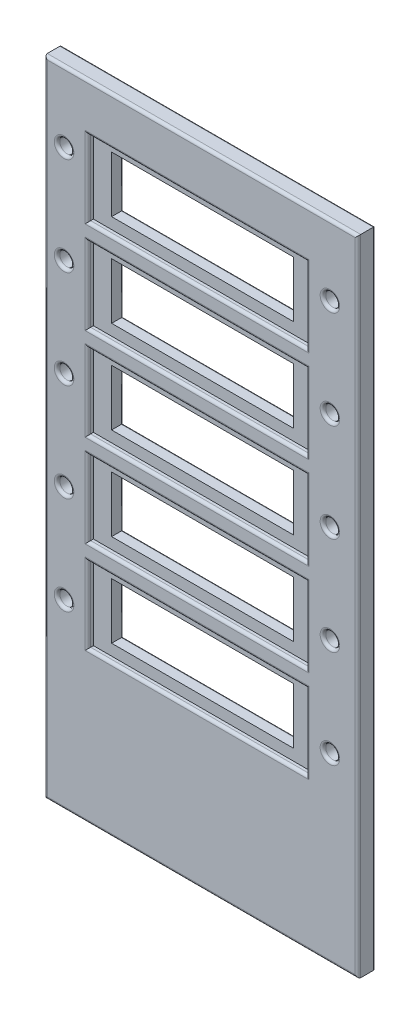
from build123d import *

# Parameters (mm, degrees)
CROQUIS1_W                   = 115
CROQUIS1_H                   = 230
SALIENTE_EXTRUIR1_DEPTH      = 2
CROQUIS2_W                   = 79
CROQUIS2_H                   = 185
CORTAR_EXTRUIR1_DEPTH        = 10
SALIENTE_EXTRUIR2_DEPTH      = 2
SALIENTE_EXTRUIR2_DEPTH_BACK = 2
CROQUIS3_W                   = 115
CROQUIS3_H                   = 230
CROQUIS4_W                   = 65
CROQUIS4_H                   = 20
CORTAR_EXTRUIR2_DEPTH        = 10
MATRIZL1_COUNT               = 5
MATRIZL1_PITCH               = 33
CROQUIS5_W                   = 112
CROQUIS5_H                   = 230
SALIENTE_EXTRUIR3_DEPTH      = 2
CROQUIS6_R                   = 2.5
CORTAR_EXTRUIR3_DEPTH        = 5
MATRIZL2_COUNT               = 5
MATRIZL2_PITCH               = 35
REDONDEO1_R                  = 1
CROQUIS7_R                   = 2.6
CROQUIS7_R_2                 = 2.386504413
CROQUIS7_R_3                 = 2.599045918
CORTAR_EXTRUIR4_DEPTH        = 4.5
REDONDEO2_R                  = 0.5
CROQUIS8_OUTSIDE_W           = 168.444
CROQUIS8_OUTSIDE_H           = 283.444
CROQUIS8_OUTSIDE_W_2         = 112
CROQUIS8_OUTSIDE_H_2         = 230
CORTAR_EXTRUIR6_DEPTH        = 10


with BuildPart() as part:
    # Croquis1 → Saliente-Extruir1 (new body)
    with BuildSketch(Plane.XY):
        Rectangle(CROQUIS1_W, CROQUIS1_H)
    extrude(amount=SALIENTE_EXTRUIR1_DEPTH)

    # Croquis2 → Cortar-Extruir1 (cut)
    with BuildSketch(Plane.XY.offset(2)):
        with Locations((0, 2.5)):
            Rectangle(CROQUIS2_W, CROQUIS2_H)
    extrude(amount=-CORTAR_EXTRUIR1_DEPTH, mode=Mode.SUBTRACT)

    # Croquis3 → Saliente-Extruir2 (add, two sides: drawn at the far end of the back side and taken through both)
    with BuildSketch(Plane.XY.offset(2).offset(-SALIENTE_EXTRUIR2_DEPTH_BACK)):
        Rectangle(CROQUIS3_W, CROQUIS3_H)
    extrude(amount=SALIENTE_EXTRUIR2_DEPTH + SALIENTE_EXTRUIR2_DEPTH_BACK)

    # Croquis4 → Cortar-Extruir2 (cut)
    with BuildSketch(Plane.XY.offset(4)):
        with Locations((0, 85)):
            Rectangle(CROQUIS4_W, CROQUIS4_H)
    cortar_extruir2 = extrude(amount=-CORTAR_EXTRUIR2_DEPTH, mode=Mode.SUBTRACT)

    # MatrizL1: Cortar-Extruir2 ×5
    with Locations(*[(0, -i * MATRIZL1_PITCH, 0) for i in range(1, MATRIZL1_COUNT)]):
        add(cortar_extruir2, mode=Mode.SUBTRACT)

    # Croquis5 → Saliente-Extruir3 (add)
    with BuildSketch(Plane.XY.offset(4)):
        with Locations((1.5, 0)):
            Rectangle(CROQUIS5_W, CROQUIS5_H)
        Polygon((-39, -34), (38.99, -34), (39, -34), (39, -61), (38.99, -61), (-39, -61), (-39.01, -61), (-39.01, -34), align=None, mode=Mode.SUBTRACT)
        Polygon((-39, -1), (38.99, -1), (39, -1), (39, -28), (38.99, -28), (-39, -28), (-39.01, -28), (-39.01, -1), align=None, mode=Mode.SUBTRACT)
        Polygon((-39, 32), (38.99, 32), (39, 32), (39, 5), (38.99, 5), (-39, 5), (-39.01, 5), (-39.01, 32), align=None, mode=Mode.SUBTRACT)
        Polygon((-39, 65), (38.99, 65), (39, 65), (39, 38), (38.99, 38), (-39, 38), (-39.01, 38), (-39.01, 65), align=None, mode=Mode.SUBTRACT)
        Polygon((-39, 98), (38.99, 98), (39, 98), (39, 71), (38.99, 71), (-39, 71), (-39.01, 71), (-39.01, 98), align=None, mode=Mode.SUBTRACT)
    extrude(amount=SALIENTE_EXTRUIR3_DEPTH)

    # Croquis6 → Cortar-Extruir3 (cut)
    with BuildSketch(Plane.XY.offset(6)):
        with Locations((-47.5, 90)):
            Circle(CROQUIS6_R)
        with Locations((47.5, 90)):
            Circle(CROQUIS6_R)
    cortar_extruir3 = extrude(amount=-CORTAR_EXTRUIR3_DEPTH, mode=Mode.SUBTRACT)

    # MatrizL2: Cortar-Extruir3 ×5
    with Locations(*[(0, -i * MATRIZL2_PITCH, 0) for i in range(1, MATRIZL2_COUNT)]):
        add(cortar_extruir3, mode=Mode.SUBTRACT)

    # Redondeo1
    redondeo1_edges = [part.edges().sort_by_distance(p)[0] for p in [
        (-0.005, 71, 6),
        (-39.01, 84.5, 6),
        (-0.005, 38, 6),
        (-39.01, 51.5, 6),
        (-0.005, 5, 6),
        (-39.01, 18.5, 6),
        (-0.005, -28, 6),
        (-39.01, -14.5, 6),
        (-0.005, -61, 6),
        (-39.01, -47.5, 6),
        (-0.005, -34, 6),
        (39, -47.5, 6),
        (-0.005, -1, 6),
        (39, -14.5, 6),
        (-0.005, 32, 6),
        (39, 18.5, 6),
        (-0.005, 65, 6),
        (39, 51.5, 6),
        (-0.005, 98, 6),
        (39, 84.5, 6),
        (1.5, 115, 6),
        (-54.5, 0, 6),
        (1.5, -115, 6),
        (57.5, 0, 6),
        (-50, 90, 6),
        (45, 90, 6),
        (-50, 55, 6),
        (-50, 20, 6),
        (-50, -15, 6),
        (-50, -50, 6),
        (45, 55, 6),
        (45, 20, 6),
        (45, -15, 6),
        (45, -50, 6),
    ]]
    fillet(redondeo1_edges, radius=REDONDEO1_R)

    # Croquis7 → Cortar-Extruir4 (cut)
    with BuildSketch(Plane(origin=(0, 0, 0), x_dir=(-1, 0, 0), z_dir=(0, 0, -1))):
        with Locations((-44.5, 105)):
            Circle(CROQUIS7_R)
        with Locations((-21.5, 105)):
            Circle(CROQUIS7_R)
        with Locations((24.5, 105)):
            Circle(CROQUIS7_R)
        with Locations((47.5, 105)):
            Circle(CROQUIS7_R)
        with Locations((47.5, 82)):
            Circle(CROQUIS7_R)
        with Locations((-44.5, 82)):
            Circle(CROQUIS7_R_2)
        with Locations((47.5, 13)):
            Circle(CROQUIS7_R)
        with Locations((-44.5, 13)):
            Circle(CROQUIS7_R_3)
        with Locations((-44.5, -10)):
            Circle(CROQUIS7_R)
        with Locations((47.5, -10)):
            Circle(CROQUIS7_R)
        with Locations((47.5, -79)):
            Circle(CROQUIS7_R)
        with Locations((47.5, -102)):
            Circle(CROQUIS7_R)
        with Locations((24.5, -102)):
            Circle(CROQUIS7_R)
        with Locations((-21.5, -102)):
            Circle(CROQUIS7_R)
        with Locations((-44.5, -102)):
            Circle(CROQUIS7_R)
        with Locations((-44.5, -79)):
            Circle(CROQUIS7_R)
    extrude(amount=-CORTAR_EXTRUIR4_DEPTH, mode=Mode.SUBTRACT)

    # Redondeo2
    redondeo2_edges = [part.edges().sort_by_distance(p)[0] for p in [
        (0, -24, 0),
        (32.5, -47, 0),
        (0, -37, 0),
        (-32.5, -47, 0),
        (0, -57, 0),
        (46.886504413, 82, 0),
        (-44.9, 13, 0),
        (47.099045918, 13, 0),
        (47.1, -10, 0),
        (-44.9, 82, 0),
        (-44.9, 105, 0),
        (-21.9, 105, 0),
        (24.1, 105, 0),
        (-44.9, -10, 0),
        (-44.9, -79, 0),
        (-44.9, -102, 0),
        (-21.9, -102, 0),
        (24.1, -102, 0),
        (47.1, -102, 0),
        (47.1, -79, 0),
        (47.1, 105, 0),
        (0, -115, 0),
        (-57.5, 0, 0),
        (32.5, 85, 0),
        (0, 75, 0),
        (-32.5, 85, 0),
        (0, 95, 0),
        (0, 115, 0),
        (57.5, 0, 0),
        (32.5, 52, 0),
        (0, 42, 0),
        (-32.5, 52, 0),
        (0, 62, 0),
        (32.5, 19, 0),
        (0, 29, 0),
        (-32.5, 19, 0),
        (0, 9, 0),
        (32.5, -14, 0),
        (0, -4, 0),
        (-32.5, -14, 0),
    ]]
    fillet(redondeo2_edges, radius=REDONDEO2_R)

    # Croquis8 outside → Cortar-Extruir6 (cut)
    with BuildSketch(Plane.XY.offset(6)):
        Rectangle(CROQUIS8_OUTSIDE_W, CROQUIS8_OUTSIDE_H)
        with Locations((1.5, 0)):
            Rectangle(CROQUIS8_OUTSIDE_W_2, CROQUIS8_OUTSIDE_H_2, mode=Mode.SUBTRACT)
    extrude(amount=-CORTAR_EXTRUIR6_DEPTH, mode=Mode.SUBTRACT)


solid = part.part
